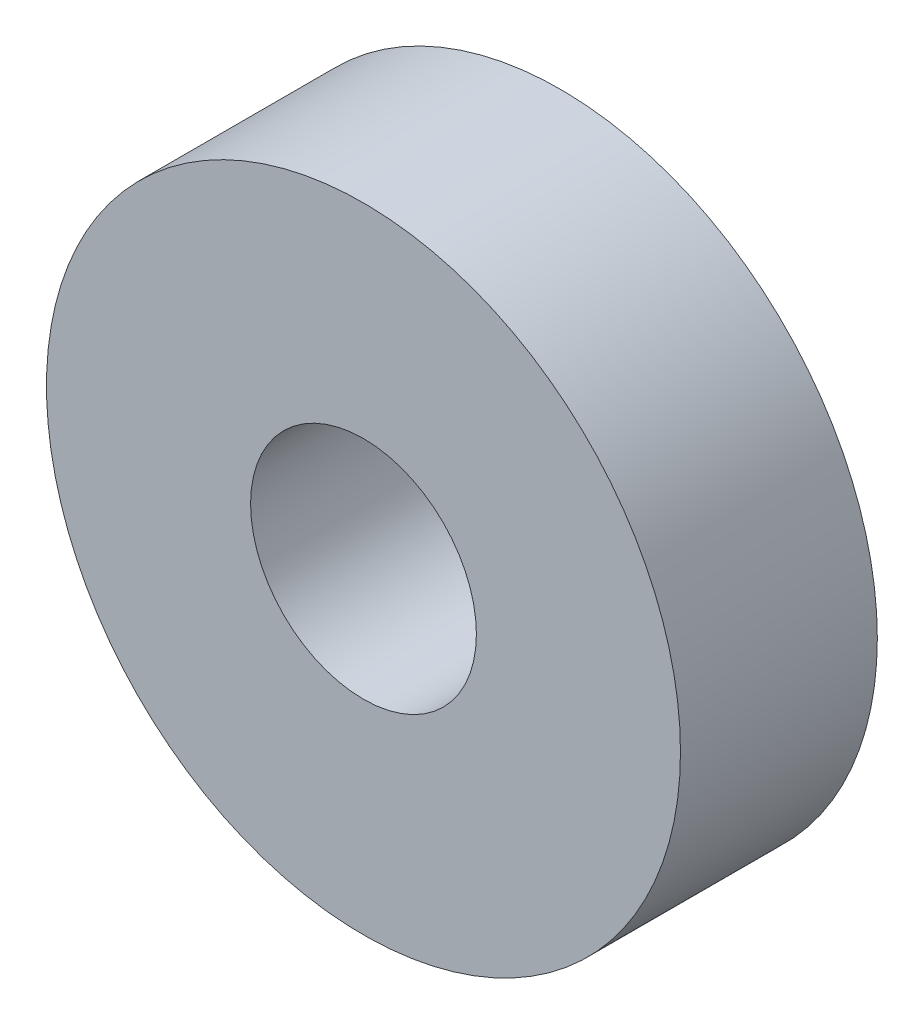
from build123d import *

# Parameters (mm, degrees)
BOSS_EXTRUDE1_DEPTH      = 3.4
BOSS_EXTRUDE1_DEPTH_BACK = 3.4
SKETCH1_R                = 10.95
SKETCH1_R_2              = 3.9


with BuildPart() as part:
    # Sketch1 → Boss-Extrude1 (new, two sides: drawn at the far end of the back side and taken through both)
    with BuildSketch(Plane.XY.offset(-BOSS_EXTRUDE1_DEPTH_BACK)):
        Circle(SKETCH1_R)
        Circle(SKETCH1_R_2, mode=Mode.SUBTRACT)
    extrude(amount=BOSS_EXTRUDE1_DEPTH + BOSS_EXTRUDE1_DEPTH_BACK)


solid = part.part
